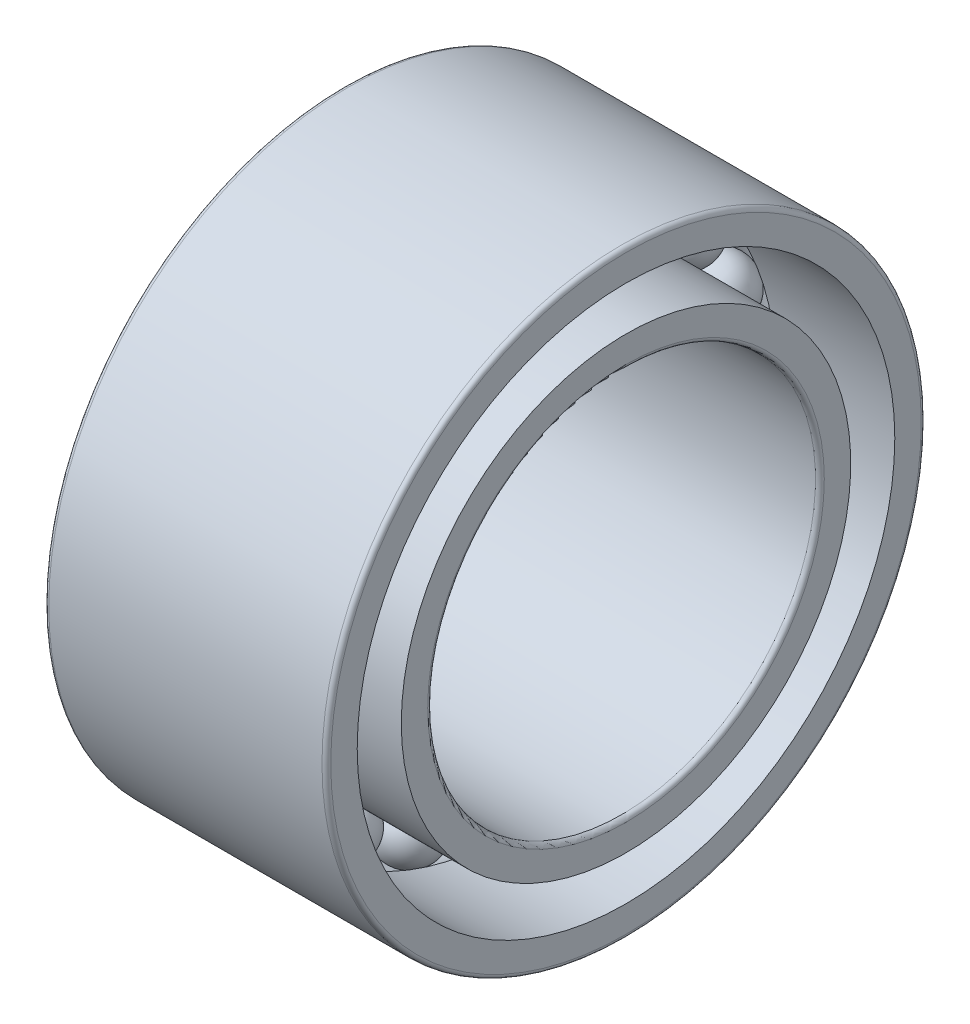
from build123d import *

# Parameters (mm, degrees)
CIRPATTERN1_COUNT = 20


with BuildPart() as part:
    # Sketch2 → Revolve1 (revolve)
    with BuildSketch(Plane.XY, mode=Mode.PRIVATE) as revolve1_sk:
        with BuildLine():
            Line((-7.75, 17), (7.75, 17))
            ThreePointArc((7.75, 17), (7.926776695, 16.926776695), (8, 16.75))
            Line((8, 16.75), (8, 15.25))
            Line((8, 15.25), (1.224744871, 15.25))
            ThreePointArc((1.224744871, 15.25), (0, 15.75), (-1.224744871, 15.25))
            Line((-1.224744871, 15.25), (-8, 15.25))
            Line((-8, 15.25), (-8, 16.75))
            ThreePointArc((-8, 16.75), (-7.926776695, 16.926776695), (-7.75, 17))
        make_face()
        with BuildLine():
            Line((8, 12.75), (8, 11.25))
            ThreePointArc((8, 11.25), (7.926776695, 11.073223305), (7.75, 11))
            Line((7.75, 11), (-7.75, 11))
            ThreePointArc((-7.75, 11), (-7.926776695, 11.073223305), (-8, 11.25))
            Line((-8, 11.25), (-8, 12.75))
            Line((-8, 12.75), (-1.224744871, 12.75))
            ThreePointArc((-1.224744871, 12.75), (0, 12.25), (1.224744871, 12.75))
            Line((1.224744871, 12.75), (8, 12.75))
        make_face()
    revolve(revolve1_sk.sketch.rotate(Axis((0, 0, 0), (1, 0, 0)), 90), axis=Axis((0, 0, 0), (1, 0, 0)))


with BuildPart() as body_2:
    # Sketch3 → Revolve2 (revolve)
    with BuildSketch(Plane.XY):
        with BuildLine():
            Line((-1.75, 14), (1.75, 14))
            ThreePointArc((1.75, 14), (0, 12.25), (-1.75, 14))
        make_face()
    revolve(axis=Axis((-1.75, 14, 0), (1, 0, 0)))


with BuildPart() as cirpattern1_1:
    # CirPattern1: pattern copy
    add(body_2.part.rotate(Axis((0, 0, 0), (1, 0, 0)), 1 * 360 / CIRPATTERN1_COUNT))


with BuildPart() as cirpattern1_2:
    # CirPattern1: pattern copy
    add(body_2.part.rotate(Axis((0, 0, 0), (1, 0, 0)), 2 * 360 / CIRPATTERN1_COUNT))


with BuildPart() as cirpattern1_3:
    # CirPattern1: pattern copy
    add(body_2.part.rotate(Axis((0, 0, 0), (1, 0, 0)), 3 * 360 / CIRPATTERN1_COUNT))


with BuildPart() as cirpattern1_4:
    # CirPattern1: pattern copy
    add(body_2.part.rotate(Axis((0, 0, 0), (1, 0, 0)), 4 * 360 / CIRPATTERN1_COUNT))


with BuildPart() as cirpattern1_5:
    # CirPattern1: pattern copy
    add(body_2.part.rotate(Axis((0, 0, 0), (1, 0, 0)), 5 * 360 / CIRPATTERN1_COUNT))


with BuildPart() as cirpattern1_6:
    # CirPattern1: pattern copy
    add(body_2.part.rotate(Axis((0, 0, 0), (1, 0, 0)), 6 * 360 / CIRPATTERN1_COUNT))


with BuildPart() as cirpattern1_7:
    # CirPattern1: pattern copy
    add(body_2.part.rotate(Axis((0, 0, 0), (1, 0, 0)), 7 * 360 / CIRPATTERN1_COUNT))


with BuildPart() as cirpattern1_8:
    # CirPattern1: pattern copy
    add(body_2.part.rotate(Axis((0, 0, 0), (1, 0, 0)), 8 * 360 / CIRPATTERN1_COUNT))


with BuildPart() as cirpattern1_9:
    # CirPattern1: pattern copy
    add(body_2.part.rotate(Axis((0, 0, 0), (1, 0, 0)), 9 * 360 / CIRPATTERN1_COUNT))


with BuildPart() as cirpattern1_10:
    # CirPattern1: pattern copy
    add(body_2.part.rotate(Axis((0, 0, 0), (1, 0, 0)), 10 * 360 / CIRPATTERN1_COUNT))


with BuildPart() as cirpattern1_11:
    # CirPattern1: pattern copy
    add(body_2.part.rotate(Axis((0, 0, 0), (1, 0, 0)), 11 * 360 / CIRPATTERN1_COUNT))


with BuildPart() as cirpattern1_12:
    # CirPattern1: pattern copy
    add(body_2.part.rotate(Axis((0, 0, 0), (1, 0, 0)), 12 * 360 / CIRPATTERN1_COUNT))


with BuildPart() as cirpattern1_13:
    # CirPattern1: pattern copy
    add(body_2.part.rotate(Axis((0, 0, 0), (1, 0, 0)), 13 * 360 / CIRPATTERN1_COUNT))


with BuildPart() as cirpattern1_14:
    # CirPattern1: pattern copy
    add(body_2.part.rotate(Axis((0, 0, 0), (1, 0, 0)), 14 * 360 / CIRPATTERN1_COUNT))


with BuildPart() as cirpattern1_15:
    # CirPattern1: pattern copy
    add(body_2.part.rotate(Axis((0, 0, 0), (1, 0, 0)), 15 * 360 / CIRPATTERN1_COUNT))


with BuildPart() as cirpattern1_16:
    # CirPattern1: pattern copy
    add(body_2.part.rotate(Axis((0, 0, 0), (1, 0, 0)), 16 * 360 / CIRPATTERN1_COUNT))


with BuildPart() as cirpattern1_17:
    # CirPattern1: pattern copy
    add(body_2.part.rotate(Axis((0, 0, 0), (1, 0, 0)), 17 * 360 / CIRPATTERN1_COUNT))


with BuildPart() as cirpattern1_18:
    # CirPattern1: pattern copy
    add(body_2.part.rotate(Axis((0, 0, 0), (1, 0, 0)), 18 * 360 / CIRPATTERN1_COUNT))


with BuildPart() as cirpattern1_19:
    # CirPattern1: pattern copy
    add(body_2.part.rotate(Axis((0, 0, 0), (1, 0, 0)), 19 * 360 / CIRPATTERN1_COUNT))


solid = Compound([part.part, body_2.part, cirpattern1_1.part, cirpattern1_2.part, cirpattern1_3.part, cirpattern1_4.part, cirpattern1_5.part, cirpattern1_6.part, cirpattern1_7.part, cirpattern1_8.part, cirpattern1_9.part, cirpattern1_10.part, cirpattern1_11.part, cirpattern1_12.part, cirpattern1_13.part, cirpattern1_14.part, cirpattern1_15.part, cirpattern1_16.part, cirpattern1_17.part, cirpattern1_18.part, cirpattern1_19.part])
